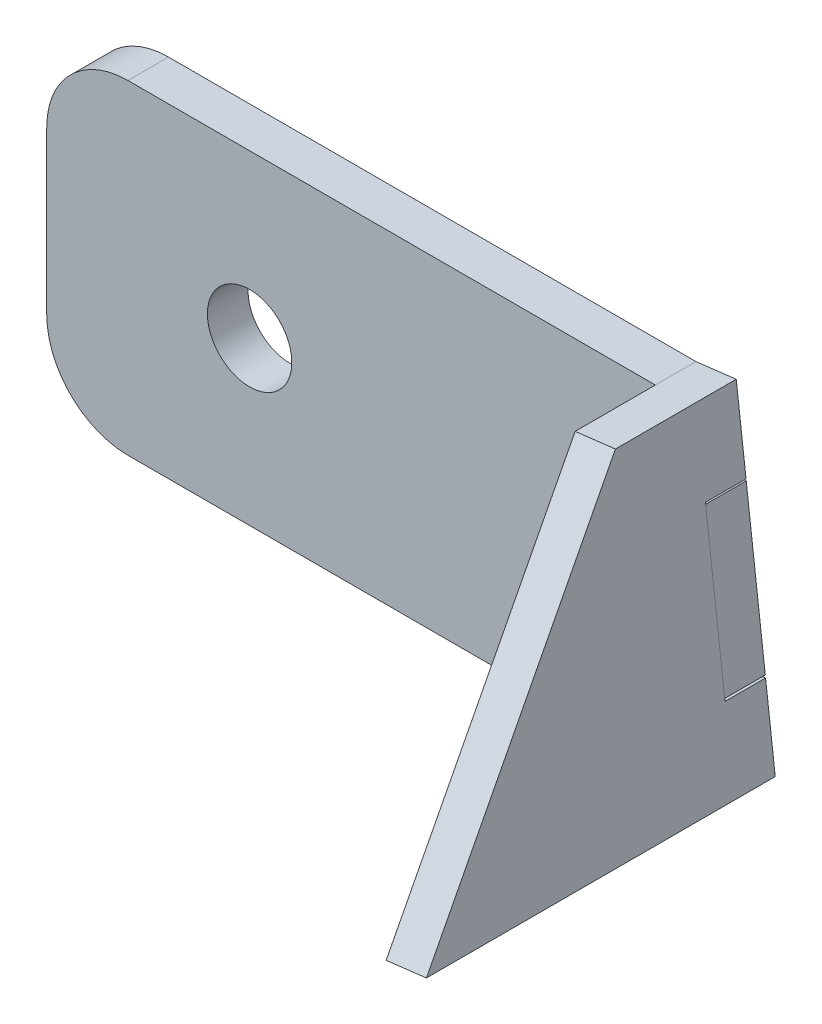
from build123d import *

# Parameters (mm, degrees)
BOSS_EXTRUDE1_DEPTH     = 3.175
CUT_EXTRUDE1_DEPTH      = 50.391408666
CUT_EXTRUDE1_DEPTH_BACK = 50.391408666
SKETCH3_R               = 3.302
BOSS_EXTRUDE2_DEPTH     = 3.175
FILLET1_R               = 6.35


with BuildPart() as part:
    # Sketch1 → Boss-Extrude1 (new body)
    with BuildSketch(Plane.XY):
        Polygon((0, 12.7), (-3.051249826, -12.7), (0, -12.7), (47.625, -12.7), (47.625, 12.7), align=None)
        Polygon((-2.271161455, -6.206187377), (-0.780088372, 6.206187377), (-3.932424596, 6.584871053), (-5.42349768, -5.827503701), align=None)
    extrude(amount=BOSS_EXTRUDE1_DEPTH)

    # Sketch3 → Cut-Extrude1 (cut, two sides: drawn at the far end of the back side and taken through both)
    with BuildSketch(Plane.XY.offset(3.175).offset(-CUT_EXTRUDE1_DEPTH_BACK)):
        with Locations((31.75, 0)):
            Circle(SKETCH3_R)
    extrude(amount=CUT_EXTRUDE1_DEPTH + CUT_EXTRUDE1_DEPTH_BACK, mode=Mode.SUBTRACT)

    # Fillet1
    fillet1_edges = [part.edges().sort_by_distance(p)[0] for p in [
        (47.625, 12.7, 1.5875),
        (47.625, -12.7, 1.5875),
    ]]
    fillet(fillet1_edges, radius=FILLET1_R)


with BuildPart() as body_2:
    # Sketch2 → Boss-Extrude2 (new body)
    with BuildSketch(Plane(origin=(-1.503922228, 0.180663088, 0), x_dir=(0, 0, 1), z_dir=(-0.9928618030717177, 0.11927044898539502, 0))):
        Polygon((0, 12.609344899), (0, 6.195844899), (3.175, 6.195844899), (3.175, -6.623268836), (0, -6.623268836), (0, -12.973268836), (27.295308913, -12.973268836), (9.453791039, 12.609344899), align=None)
    extrude(amount=BOSS_EXTRUDE2_DEPTH)


with BuildPart() as body_3:
    # Mirror2: mirrored copy
    add(body_2.part.mirror(Plane(origin=(0, 0, 0), x_dir=(0, 0, 1), z_dir=(1, 0, 0))))


with BuildPart() as body_4:
    # Mirror2 2: mirrored copy
    add(part.part.mirror(Plane(origin=(0, 0, 0), x_dir=(0, 0, 1), z_dir=(1, 0, 0))))


solid = Compound([body_3.part, body_4.part])
